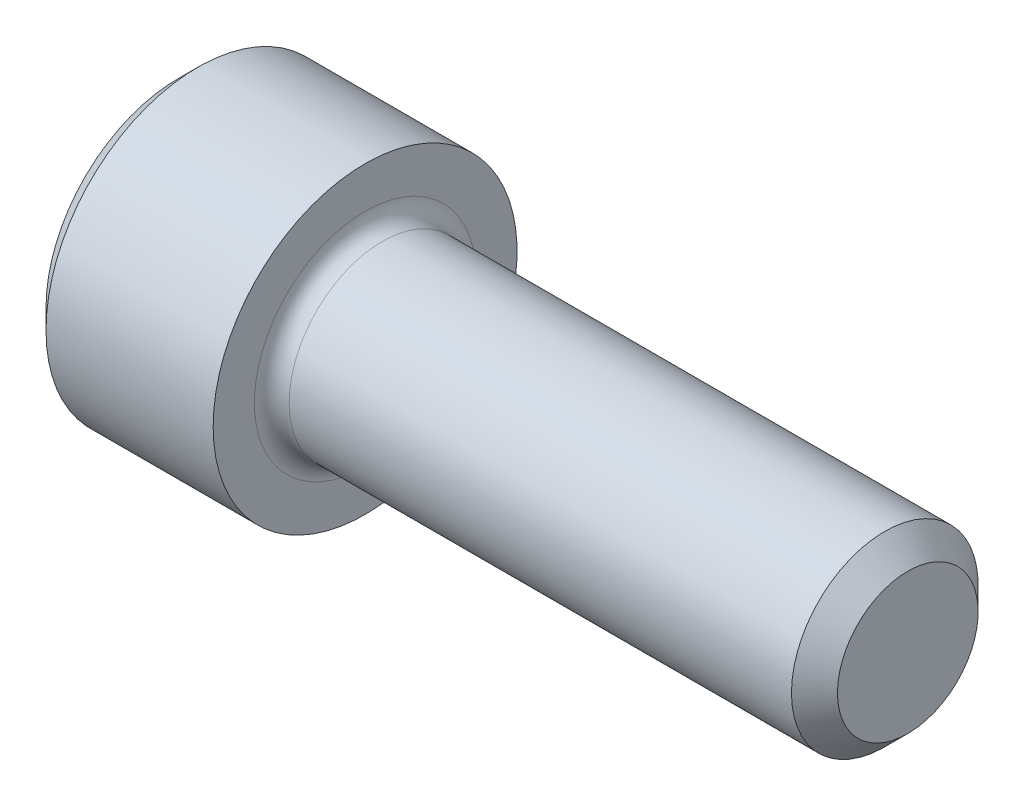
from build123d import *

# Parameters (mm, degrees)
FILLET1_R   = 0.2032
HEX_2_DEPTH = 0.9652


with BuildPart() as part:
    # BodySke → Base-Revolve (revolve)
    with BuildSketch(Plane.XY, mode=Mode.PRIVATE) as base_revolve_sk:
        Polygon((0, 0), (0, 1.5494), (0.2286, 1.778), (2.1844, 1.778), (2.1844, 1.0922), (8.26516, 1.0922), (8.5344, 0.82296), (8.5344, 0), align=None)
    revolve(base_revolve_sk.sketch.rotate(Axis((-31.75, 0, 0), (1, 0, 0)), 90), axis=Axis((-31.75, 0, 0), (1, 0, 0)))

    # Fillet1
    fillet1_edges = [part.edges().sort_by_distance(p)[0] for p in [
        (2.1844, 0, -1.0922),
    ]]
    fillet(fillet1_edges, radius=FILLET1_R)

    # Sketch2 → Hex-PreBroach (revolve, cut)
    with BuildSketch(Plane.XY, mode=Mode.PRIVATE) as hex_prebroach_sk:
        Polygon((0, 0.9906), (0.9652, 0.9906), (1.537123177, 0), (0, 0), align=None)
    revolve(hex_prebroach_sk.sketch.rotate(Axis((0, 0, 0), (1, 0, 0)), 90), axis=Axis((0, 0, 0), (1, 0, 0)), mode=Mode.SUBTRACT)

    # Sketch3 → Hex 2 (cut)
    with BuildSketch(Plane(origin=(0, 0, 0), x_dir=(0, 0.500000000000001, 0.866025403784438), z_dir=(-1, 0, 0))):
        Polygon((0.571923177, 0.9906), (-0.571923177, 0.9906), (-1.143846353, 0), (-0.571923177, -0.9906), (0.571923177, -0.9906), (1.143846353, 0), align=None)
    extrude(amount=-HEX_2_DEPTH, mode=Mode.SUBTRACT)


solid = part.part
